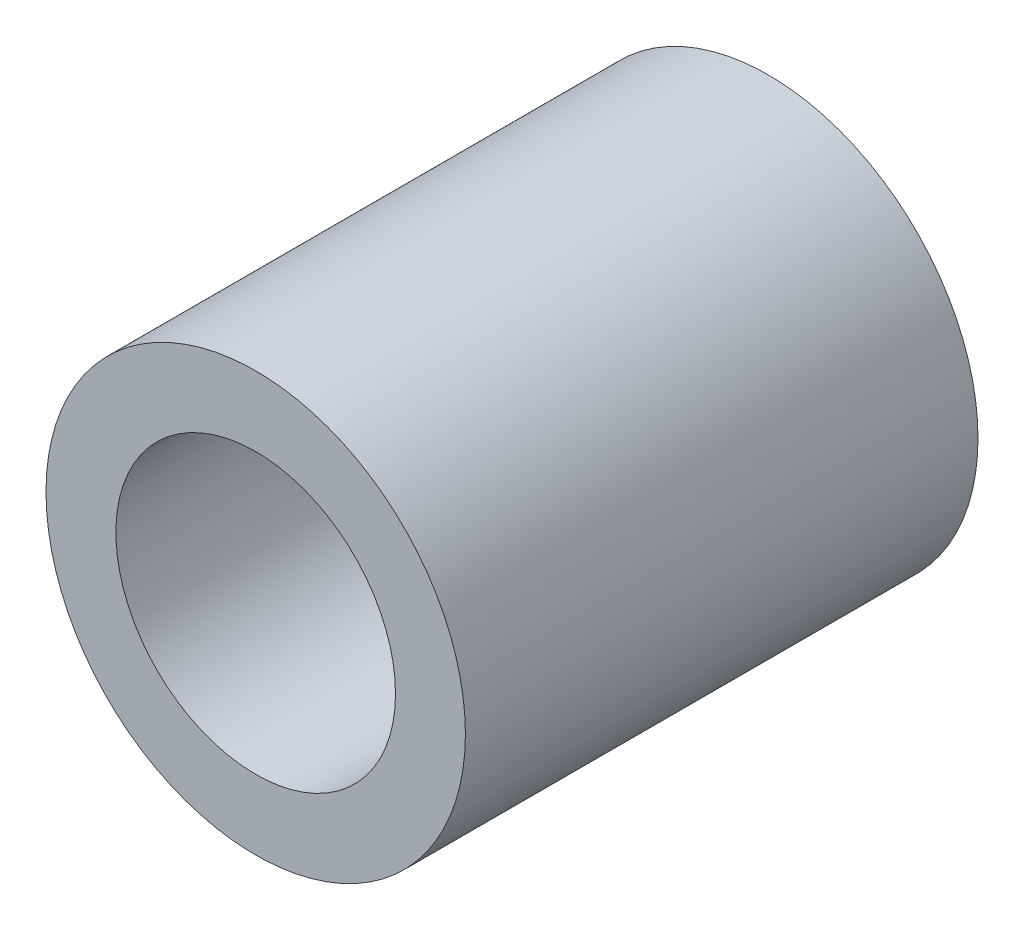
from build123d import *

# Parameters (mm, degrees)
SKETCH1_R           = 9
SKETCH1_R_2         = 6
BOSS_EXTRUDE1_DEPTH = 11


with BuildPart() as part:
    # Sketch1 → Boss-Extrude1 (new, symmetric)
    with BuildSketch(Plane.XY):
        Circle(SKETCH1_R)
        Circle(SKETCH1_R_2, mode=Mode.SUBTRACT)
    extrude(amount=BOSS_EXTRUDE1_DEPTH, both=True)


solid = part.part
